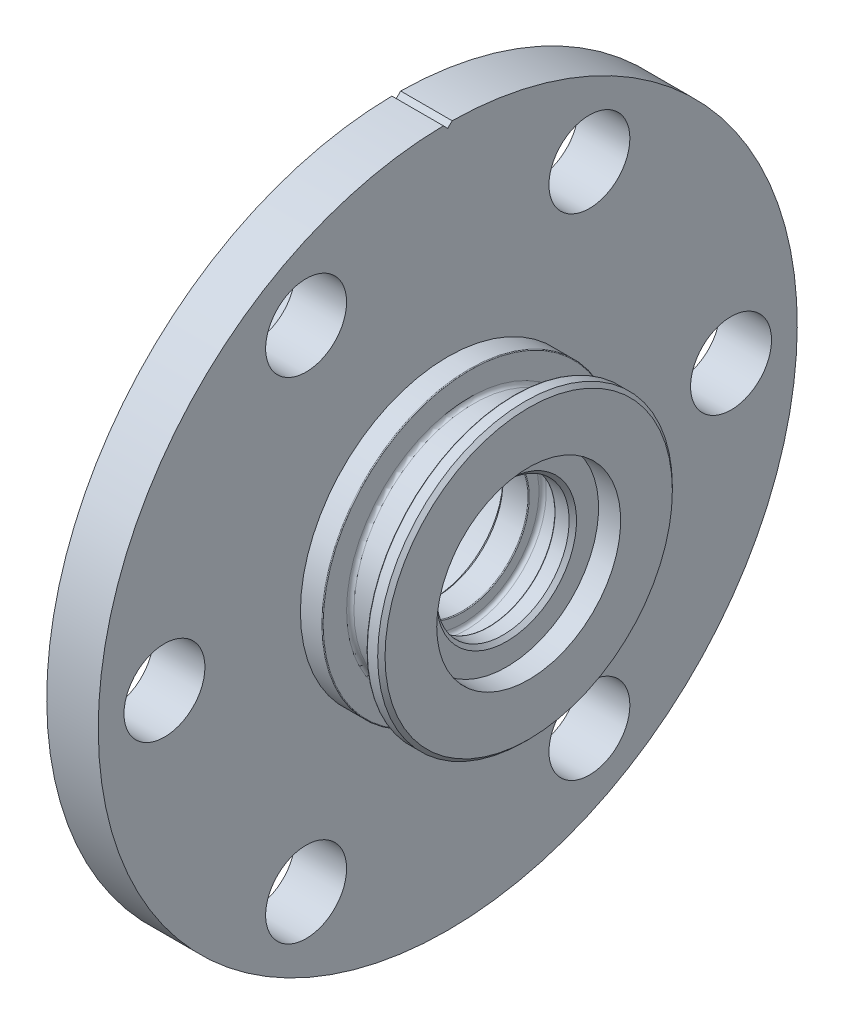
from build123d import *

# Parameters (mm, degrees)
SKETCH_2_R               = 5.5
CUT_EXTRUDE_1_DEPTH      = 70.810457669
PATTERN_CIRCULAR_1_COUNT = 6
CUT_EXTRUDE_2_DEPTH      = 70.810457669
CUT_EXTRUDE_3_DEPTH      = 4
CUT_EXTRUDE_4_DEPTH      = 3
CUT_EXTRUDE_5_DEPTH      = 0.5
CUT_EXTRUDE_6_DEPTH      = 0.5


with BuildPart() as part:
    # Эскиз1 → Повернуть1 (revolve)
    with BuildSketch(Plane.XY, mode=Mode.PRIVATE) as revolve_1_sk:
        with BuildLine():
            Line((0, 15), (17, 15))
            Line((17, 15), (17, 9.5))
            Line((17, 9.5), (17.5, 9))
            Line((17.5, 9), (20.9, 9))
            ThreePointArc((20.9, 9), (20.970710678, 9.029289322), (21, 9.1))
            Line((21, 9.1), (21, 10.4))
            ThreePointArc((21, 10.4), (21.146446609, 10.753553391), (21.5, 10.9))
            Line((21.5, 10.9), (24, 10.9))
            ThreePointArc((24, 10.9), (24.353553391, 10.753553391), (24.5, 10.4))
            Line((24.5, 10.4), (24.5, 9.1))
            ThreePointArc((24.5, 9.1), (24.529289322, 9.029289322), (24.6, 9))
            Line((24.6, 9), (26.5, 9))
            Line((26.5, 9), (27, 9.5))
            Line((27, 9.5), (27, 12.5))
            Line((27, 12.5), (30, 12.5))
            Line((30, 12.5), (30, 19.525))
            Line((30, 19.525), (29.5, 20.025))
            Line((29.5, 20.025), (28.1, 20.025))
            ThreePointArc((28.1, 20.025), (28.029289322, 19.995710678), (28, 19.925))
            Line((28, 19.925), (28, 16.75))
            ThreePointArc((28, 16.75), (27.853553391, 16.396446609), (27.5, 16.25))
            Line((27.5, 16.25), (22.5, 16.25))
            ThreePointArc((22.5, 16.25), (22.146446609, 16.396446609), (22, 16.75))
            Line((22, 16.75), (22, 19.925))
            ThreePointArc((22, 19.925), (21.970710678, 19.995710678), (21.9, 20.025))
            Line((21.9, 20.025), (19, 20.025))
            Line((19, 20.025), (19, 47.5))
            Line((19, 47.5), (12, 47.5))
            Line((12, 47.5), (12, 25))
            Line((12, 25), (0, 25))
            Line((0, 25), (0, 15))
        make_face()
    revolve(revolve_1_sk.sketch.rotate(Axis((0, 0, 0), (1, 0, 0)), 90), axis=Axis((0, 0, 0), (1, 0, 0)))

    # Эскиз2 → Вырез-Вытянуть1 (cut, through all)
    with BuildSketch(Plane(origin=(19, 0, 0), x_dir=(0, 0, -1), z_dir=(1, 0, 0))):
        with Locations((38.5, 0)):
            Circle(SKETCH_2_R)
    cut_extrude_1 = extrude(amount=-CUT_EXTRUDE_1_DEPTH, mode=Mode.SUBTRACT)

    # Круговой массив1: Вырез-Вытянуть1 ×6 about axis
    pattern_circular_1_axis = Axis((0, 0, 0), (1, 0, 0))
    for i in range(1, PATTERN_CIRCULAR_1_COUNT):
        add(cut_extrude_1.rotate(pattern_circular_1_axis, i * 360 / PATTERN_CIRCULAR_1_COUNT), mode=Mode.SUBTRACT)

    # Эскиз3 → Вырез-Вытянуть2 (cut, through all)
    with BuildSketch(Plane(origin=(19, 0, 0), x_dir=(0, 0, -1), z_dir=(1, 0, 0))):
        with BuildLine():
            Line((-0.596257505, 47.496257505), (0, 46.9))
            Line((0, 46.9), (0.596257505, 47.496257505))
            ThreePointArc((0.596257505, 47.496257505), (0, 47.5), (-0.596257505, 47.496257505))
        make_face()
    extrude(amount=-CUT_EXTRUDE_2_DEPTH, mode=Mode.SUBTRACT)

    # Эскиз4 → Вырез-Вытянуть3 (cut)
    with BuildSketch(Plane.ZY):
        with BuildLine():
            Line((-22.449944321, -11), (-10.198039027, -11))
            ThreePointArc((-10.198039027, -11), (-12.990381057, 7.5), (4.427259928, 14.331760866))
            Line((4.427259928, 14.331760866), (-1.698692719, 24.942222095))
            ThreePointArc((-1.698692719, 24.942222095), (-21.650635095, 12.5), (-22.449944321, -11))
        make_face()
    extrude(amount=-CUT_EXTRUDE_3_DEPTH, mode=Mode.SUBTRACT)

    # Эскиз5 → Вырез-Вытянуть4 (cut)
    with BuildSketch(Plane.ZY.offset(-4)):
        with BuildLine():
            Line((-24.787849846, -3.25), (-14.643684646, -3.25))
            ThreePointArc((-14.643684646, -3.25), (-15, 0), (-14.643684646, 3.25))
            Line((-14.643684646, 3.25), (-24.787849846, 3.25))
            ThreePointArc((-24.787849846, 3.25), (-25, 0), (-24.787849846, -3.25))
        make_face()
        with BuildLine():
            Line((-15.208507485, 19.841907672), (-10.136424885, 11.056802908))
            ThreePointArc((-10.136424885, 11.056802908), (-7.5, 12.990381057), (-4.507259761, 14.306802908))
            Line((-4.507259761, 14.306802908), (-9.579342361, 23.091907672))
            ThreePointArc((-9.579342361, 23.091907672), (-12.5, 21.650635095), (-15.208507485, 19.841907672))
        make_face()
    extrude(amount=-CUT_EXTRUDE_4_DEPTH, mode=Mode.SUBTRACT)

    # Эскиз6 → Вырез-Вытянуть5 (cut)
    # profile 1 of 4: a face of its own
    with BuildSketch(Plane.ZY.offset(-12)):
        with BuildLine():
            Line((-0.180554406, 39.477018573), (0.357907132, 42.078180432))
            add(Edge.make_bspline(
                [(0.357907132, 42.078180432), (0.327144435, 42.055049142), (0.264132599, 42.007668867), (0.161224433, 41.943863239), (0.05006028, 41.882293935), (-0.070751591, 41.825598544), (-0.199878164, 41.770132642), (-0.338940831, 41.720698495), (-0.486111877, 41.672171644), (-0.588223671, 41.644849669), (-0.640490304, 41.630864726)],
                knots=[0, 0, 0, 0, 0.838359274, 1.717227777, 2.63582179, 3.606248445, 4.624055798, 5.697042507, 6.821215173, 8, 8, 8, 8], degree=3))
            Line((-0.640490304, 41.630864726), (-0.560562419, 41.989839085))
            add(Edge.make_bspline(
                [(-0.560562419, 41.989839085), (-0.507209173, 42.013756687), (-0.399270795, 42.06214413), (-0.241266586, 42.147063614), (-0.08349029, 42.240751127), (0.044089891, 42.327913735), (0.143742968, 42.399707853), (0.214231776, 42.451889885), (0.279749679, 42.502534023), (0.340126411, 42.551556729), (0.395379775, 42.599197515), (0.445871232, 42.644779087), (0.491867065, 42.68810806), (0.519756203, 42.717480305), (0.533187581, 42.731625944)],
                knots=[0, 0, 0, 0, 1.583313545, 3.203184633, 4.855583746, 6.551690609, 7.386215473, 8.182603945, 8.927160296, 9.629134756, 10.288998473, 10.903058912, 11.471714409, 12, 12, 12, 12], degree=3))
            add(Edge.make_bspline(
                [(0.533187581, 42.731625944), (0.54862987, 42.749182437), (0.580285751, 42.785172326), (0.623996935, 42.844365542), (0.667114487, 42.908431815), (0.69396942, 42.953740133), (0.707766908, 42.977018573)],
                knots=[0, 0, 0, 0, 0.929584414, 1.905599249, 2.923941894, 4, 4, 4, 4], degree=3))
            Line((0.707766908, 42.977018573), (0.949653927, 42.977018573))
            Line((0.949653927, 42.977018573), (0.230302966, 39.477018573))
            Line((0.230302966, 39.477018573), (-0.180554406, 39.477018573))
        make_face()
    # profile 2 of 4: a face of its own
    with BuildSketch(Plane.ZY.offset(-12)):
        with BuildLine():
            add(Edge.make_bspline(
                [(33.658708126, 20.6558349), (33.70781934, 20.671067075), (33.80244326, 20.700415322), (33.942982258, 20.731002115), (34.07527117, 20.751407215), (34.201975519, 20.759193075), (34.325829957, 20.756482967), (34.450405191, 20.742465624), (34.577434975, 20.720198397), (34.686367299, 20.69285953), (34.780722389, 20.663773108), (34.864852683, 20.636380514), (34.961567209, 20.603287896), (35.071075572, 20.564842528), (35.192886696, 20.51968141), (35.327331683, 20.469365122), (35.474353949, 20.413081675), (35.576304887, 20.373122717), (35.629561491, 20.352249163)],
                knots=[0, 0, 0, 0, 1.204779305, 2.321281203, 3.367971213, 4.339492292, 5.292959753, 6.268180703, 7.275121332, 8.31414202, 8.898160544, 9.589397699, 10.388039475, 11.294205731, 12.309856272, 13.43320494, 14.659170863, 16, 16, 16, 16], degree=3))
            add(Edge.make_bspline(
                [(35.629561491, 20.352249163), (35.661761364, 20.339493414), (35.723665541, 20.314970518), (35.813761481, 20.281774786), (35.896133543, 20.250400904), (35.971850624, 20.224145809), (36.040182159, 20.20055545), (36.101514827, 20.18121014), (36.155643291, 20.164714375), (36.189497352, 20.15583998), (36.205182485, 20.151728329)],
                knots=[0, 0, 0, 0, 1.362870858, 2.620115953, 3.77833347, 4.831281057, 5.773586764, 6.622888737, 7.361962113, 8, 8, 8, 8], degree=3))
            add(Edge.make_bspline(
                [(36.205182485, 20.151728329), (36.245486949, 20.142398003), (36.323263041, 20.124393142), (36.438228858, 20.10933454), (36.546162786, 20.10259052), (36.615578372, 20.106890191), (36.648992581, 20.1089599)],
                knots=[0, 0, 0, 0, 1.107911723, 2.137952887, 3.103676364, 4, 4, 4, 4], degree=3))
            add(Edge.make_bspline(
                [(36.648992581, 20.1089599), (36.671079966, 20.111890814), (36.715350813, 20.117765392), (36.779870162, 20.137045291), (36.843957367, 20.161117958), (36.884339566, 20.183234895), (36.904902036, 20.194496759)],
                knots=[0, 0, 0, 0, 0.982488777, 1.969251264, 2.965950105, 4, 4, 4, 4], degree=3))
            add(Edge.make_bspline(
                [(36.904902036, 20.194496759), (36.921735941, 20.204661743), (36.954834259, 20.224647828), (36.99979837, 20.260353596), (37.041103649, 20.298705349), (37.07621987, 20.341877457), (37.108733234, 20.386920884), (37.1352222, 20.436298417), (37.15683223, 20.489285068), (37.174483505, 20.544773791), (37.185886039, 20.601957436), (37.193484681, 20.659098713), (37.194207645, 20.71606109), (37.188108549, 20.77231293), (37.178045578, 20.828168698), (37.160737988, 20.882971738), (37.138286262, 20.937461246), (37.119307678, 20.972435148), (37.1096296, 20.990269996)],
                knots=[0, 0, 0, 0, 1.029422278, 2.024019106, 3.002884985, 3.976604764, 4.934720418, 5.910132956, 6.903975558, 7.930406914, 8.955961227, 9.955446647, 10.947476769, 11.932071302, 12.916818143, 13.916228535, 14.937386339, 16, 16, 16, 16], degree=3))
            add(Edge.make_bspline(
                [(37.1096296, 20.990269996), (37.099258991, 21.007585275), (37.078789479, 21.041762181), (37.041774911, 21.088124327), (37.001426387, 21.130020511), (36.959096922, 21.169706288), (36.910604159, 21.201808729), (36.860157682, 21.231772525), (36.805809736, 21.257263669), (36.747471835, 21.277315328), (36.685664583, 21.293159702), (36.619805051, 21.301878929), (36.55015746, 21.30548299), (36.476499016, 21.302493311), (36.399036321, 21.292936928), (36.317504887, 21.278253712), (36.232125034, 21.257098872), (36.174481313, 21.239228575), (36.14488601, 21.23005365)],
                knots=[0, 0, 0, 0, 0.890791895, 1.7582455, 2.61263812, 3.46058193, 4.313975991, 5.174521437, 6.052053172, 6.959735025, 7.89619894, 8.865656837, 9.889025904, 10.973821993, 12.117354432, 13.334393261, 14.63143049, 16, 16, 16, 16], degree=3))
            Line((36.14488601, 21.23005365), (35.987834728, 21.625486342))
            add(Edge.make_bspline(
                [(35.987834728, 21.625486342), (36.023377912, 21.63942523), (36.09309944, 21.66676776), (36.199330193, 21.696511893), (36.303792639, 21.717931387), (36.406527864, 21.730339642), (36.507985583, 21.731403691), (36.60748786, 21.723810365), (36.705718407, 21.707042489), (36.801368025, 21.680222967), (36.894132268, 21.645205344), (36.982655084, 21.601921046), (37.065716279, 21.549507597), (37.143823416, 21.489633923), (37.217501383, 21.421976991), (37.285105325, 21.345109974), (37.348750098, 21.260905178), (37.385911661, 21.200010463), (37.404801876, 21.169056054)],
                knots=[0, 0, 0, 0, 1.115855542, 2.188862788, 3.220910342, 4.232248558, 5.209649385, 6.183027772, 7.147052098, 8.118701484, 9.083379673, 10.04310653, 10.995014708, 11.950498094, 12.917787316, 13.91498675, 14.940132114, 16, 16, 16, 16], degree=3))
            add(Edge.make_bspline(
                [(37.404801876, 21.169056054), (37.427786379, 21.12630376), (37.472887094, 21.042414237), (37.522171415, 20.91024722), (37.553883536, 20.776429714), (37.569586568, 20.642495513), (37.567887374, 20.510617787), (37.54787882, 20.383741948), (37.507941205, 20.263618397), (37.450101935, 20.152206611), (37.379608582, 20.050322016), (37.298935448, 19.959891575), (37.209853823, 19.880579501), (37.142998173, 19.838831404), (37.1096296, 19.817994355)],
                knots=[0, 0, 0, 0, 1.127989899, 2.21336743, 3.269451819, 4.31995369, 5.342013454, 6.327707805, 7.295477983, 8.272773045, 9.237791438, 10.169519232, 11.086381901, 12, 12, 12, 12], degree=3))
            add(Edge.make_bspline(
                [(37.1096296, 19.817994355), (37.084399482, 19.804171889), (37.033876791, 19.776492739), (36.953372801, 19.743888494), (36.869977682, 19.717588936), (36.783206349, 19.699917522), (36.693769166, 19.687330493), (36.60088303, 19.683991325), (36.504760752, 19.68528067), (36.440018138, 19.692851549), (36.407105562, 19.696700284)],
                knots=[0, 0, 0, 0, 0.950163752, 1.902679592, 2.865321406, 3.836448888, 4.826229905, 5.846936954, 6.90546815, 8, 8, 8, 8], degree=3))
            add(Edge.make_bspline(
                [(36.407105562, 19.696700284), (36.395873699, 19.698492607), (36.371695697, 19.702350808), (36.333157753, 19.710277491), (36.289590333, 19.719967898), (36.241214034, 19.732702955), (36.188053967, 19.748352986), (36.129525039, 19.765796681), (36.066272916, 19.786174649), (35.997916154, 19.808517471), (35.925176328, 19.834049445), (35.847168322, 19.861115332), (35.764449991, 19.891721128), (35.676300273, 19.923459173), (35.583595885, 19.958742559), (35.486106708, 19.996886688), (35.383367174, 20.03648651), (35.313338862, 20.064045298), (35.27759835, 20.078110541)],
                knots=[0, 0, 0, 0, 0.457246047, 0.984279848, 1.581521093, 2.251567047, 2.995007651, 3.809514434, 4.706951792, 5.666714152, 6.700824875, 7.806324329, 8.986417404, 10.246789651, 11.573106774, 12.974297352, 14.455765103, 16, 16, 16, 16], degree=3))
            add(Edge.make_bspline(
                [(35.27759835, 20.078110541), (35.247004644, 20.090086269), (35.187551502, 20.113358855), (35.100608509, 20.146315664), (35.018568104, 20.176450836), (34.941581192, 20.203976877), (34.86957926, 20.227831399), (34.802319425, 20.248050978), (34.740580941, 20.26653598), (34.665876399, 20.285748047), (34.579258602, 20.304721248), (34.48090738, 20.322206939), (34.389008558, 20.33176024), (34.329934178, 20.332340027), (34.301636812, 20.332617752)],
                knots=[0, 0, 0, 0, 1.165771828, 2.265459344, 3.299162083, 4.266999938, 5.166485247, 5.990184484, 6.759087513, 7.453007125, 8.726665259, 9.904584845, 10.996269963, 12, 12, 12, 12], degree=3))
            Line((34.301636812, 20.332617752), (35.081985369, 18.981556054))
            Line((35.081985369, 18.981556054), (34.697770626, 18.856055252))
            Line((34.697770626, 18.856055252), (33.658708126, 20.6558349))
        make_face()
    # profile 3 of 4: a face of its own
    with BuildSketch(Plane.ZY.offset(-12)):
        with BuildLine():
            Line((-36.969019669, -20.099422896), (-36.713811335, -20.435260235))
            add(Edge.make_bspline(
                [(-36.713811335, -20.435260235), (-36.737143841, -20.453717847), (-36.782413341, -20.489529127), (-36.844958157, -20.54546256), (-36.899578254, -20.601810945), (-36.948054085, -20.657059859), (-36.98794823, -20.713129227), (-37.020354994, -20.768836515), (-37.046529998, -20.823899548), (-37.063597763, -20.87953353), (-37.075347174, -20.934914308), (-37.079922645, -20.990681664), (-37.079574753, -21.046629907), (-37.072114752, -21.102729203), (-37.059439698, -21.159048394), (-37.041058785, -21.215782548), (-37.017394953, -21.273051449), (-36.99697643, -21.309747152), (-36.986547713, -21.328489402)],
                knots=[0, 0, 0, 0, 1.369991066, 2.658043362, 3.860650297, 4.982569779, 6.039844813, 7.023792536, 7.948437492, 8.840301675, 9.697322654, 10.550957523, 11.412091524, 12.269180089, 13.15177349, 14.067416344, 15.012937116, 16, 16, 16, 16], degree=3))
            add(Edge.make_bspline(
                [(-36.986547713, -21.328489402), (-36.973008483, -21.350792493), (-36.946158399, -21.395022468), (-36.897781903, -21.454888498), (-36.846367679, -21.510304627), (-36.788466143, -21.55802604), (-36.727085393, -21.601010978), (-36.660292634, -21.637763538), (-36.588921211, -21.668527595), (-36.513454694, -21.69269042), (-36.436840704, -21.710848274), (-36.360777544, -21.721699502), (-36.286582555, -21.724112409), (-36.214213479, -21.72117743), (-36.143412888, -21.709777646), (-36.07468452, -21.690613603), (-36.007536573, -21.664879048), (-35.965258583, -21.642125172), (-35.943979604, -21.630672896)],
                knots=[0, 0, 0, 0, 1.041625132, 2.065680238, 3.06994913, 4.05779477, 5.057928611, 6.061328383, 7.098925301, 8.159352125, 9.224212466, 10.24267195, 11.224138038, 12.187344575, 13.133276971, 14.082753663, 15.035028809, 16, 16, 16, 16], degree=3))
            add(Edge.make_bspline(
                [(-35.943979604, -21.630672896), (-35.925956669, -21.619838539), (-35.890647438, -21.598612651), (-35.843032099, -21.560813255), (-35.799490773, -21.520810773), (-35.761811798, -21.476654884), (-35.72940445, -21.429278247), (-35.701578583, -21.378942196), (-35.67928544, -21.32508443), (-35.662548126, -21.268185278), (-35.651247093, -21.209499617), (-35.646349981, -21.149794192), (-35.647815346, -21.08940314), (-35.655607419, -21.028581453), (-35.669593863, -20.966926242), (-35.691325859, -20.905370112), (-35.71754521, -20.8423224), (-35.740231038, -20.801738726), (-35.751872233, -20.78091328)],
                knots=[0, 0, 0, 0, 1.029331314, 2.016591381, 2.972608994, 3.92277935, 4.853428351, 5.781043041, 6.735894067, 7.703296896, 8.682488308, 9.659132008, 10.632750058, 11.636932618, 12.659169198, 13.72381926, 14.831981622, 16, 16, 16, 16], degree=3))
            add(Edge.make_bspline(
                [(-35.751872233, -20.78091328), (-35.755591517, -20.774824341), (-35.764515348, -20.760214901), (-35.780910378, -20.734759243), (-35.802300771, -20.702034845), (-35.819093325, -20.678256893), (-35.828294508, -20.665228184)],
                knots=[0, 0, 0, 0, 0.617384292, 1.481315283, 2.619931199, 4, 4, 4, 4], degree=3))
            Line((-35.828294508, -20.665228184), (-35.48123922, -20.549543088))
            add(Edge.make_bspline(
                [(-35.48123922, -20.549543088), (-35.473352026, -20.56837862), (-35.457951102, -20.605157811), (-35.439203716, -20.64034761), (-35.430057329, -20.657515844)],
                knots=[0, 0, 0, 0, 1.024249383, 2, 2, 2, 2], degree=3))
            add(Edge.make_bspline(
                [(-35.430057329, -20.657515844), (-35.414801662, -20.683021081), (-35.385019885, -20.732811841), (-35.334787655, -20.801124244), (-35.283982823, -20.863593267), (-35.229820116, -20.917700431), (-35.173373871, -20.964262254), (-35.115173994, -21.003986563), (-35.054330966, -21.035605986), (-34.992134721, -21.060387055), (-34.928897413, -21.076835761), (-34.866262569, -21.087561168), (-34.804236352, -21.091998561), (-34.743046674, -21.089251093), (-34.682907328, -21.079163264), (-34.623785684, -21.062815083), (-34.565143894, -21.040763475), (-34.528193851, -21.020460434), (-34.509484412, -21.010180107)],
                knots=[0, 0, 0, 0, 1.287028092, 2.512507782, 3.670349145, 4.773073973, 5.823309793, 6.837229631, 7.820130982, 8.788580591, 9.731818402, 10.645791963, 11.538997133, 12.420937503, 13.29329128, 14.17523165, 15.07603919, 16, 16, 16, 16], degree=3))
            add(Edge.make_bspline(
                [(-34.509484412, -21.010180107), (-34.492644717, -21.00002244), (-34.459535014, -20.98005074), (-34.414778977, -20.944340429), (-34.373538509, -20.906736652), (-34.337931698, -20.864883764), (-34.305897341, -20.820672341), (-34.279137708, -20.772644407), (-34.257644133, -20.721216948), (-34.240110536, -20.667548192), (-34.227616901, -20.612650529), (-34.220140925, -20.557482836), (-34.219908034, -20.502950479), (-34.223878254, -20.448923744), (-34.233778207, -20.395569247), (-34.249369495, -20.342761664), (-34.270339374, -20.290520451), (-34.288518711, -20.257239909), (-34.29774563, -20.240348376)],
                knots=[0, 0, 0, 0, 1.059362376, 2.082886426, 3.081592175, 4.064427905, 5.040127438, 6.021831334, 7.021331915, 8.041592118, 9.062708146, 10.053751079, 11.036829174, 11.997601602, 12.971508916, 13.956523795, 14.962834013, 16, 16, 16, 16], degree=3))
            add(Edge.make_bspline(
                [(-34.29774563, -20.240348376), (-34.307749273, -20.224267097), (-34.327610626, -20.192339133), (-34.362292136, -20.147890148), (-34.400791458, -20.107269999), (-34.443041469, -20.070595773), (-34.489173178, -20.038144892), (-34.538994853, -20.009163511), (-34.593275136, -19.98501265), (-34.650484699, -19.963756281), (-34.710561838, -19.947721744), (-34.772748168, -19.937179819), (-34.836589665, -19.932101799), (-34.902287976, -19.933864005), (-34.969576592, -19.940855331), (-35.038433797, -19.95371177), (-35.109108201, -19.971792591), (-35.155806643, -19.98849365), (-35.179756848, -19.997059113)],
                knots=[0, 0, 0, 0, 0.909723662, 1.806176172, 2.703964625, 3.59576094, 4.490170531, 5.411058555, 6.361077004, 7.341805999, 8.341707468, 9.344380847, 10.369513512, 11.414332179, 12.498439584, 13.617589987, 14.778134637, 16, 16, 16, 16], degree=3))
            Line((-35.179756848, -19.997059113), (-35.31717672, -19.587603985))
            add(Edge.make_bspline(
                [(-35.31717672, -19.587603985), (-35.282264815, -19.577871218), (-35.213726206, -19.558763974), (-35.110344214, -19.541152751), (-35.009653532, -19.530361906), (-34.911148836, -19.527069389), (-34.814685912, -19.533545212), (-34.720467098, -19.548492488), (-34.628321153, -19.570609643), (-34.539395332, -19.601819146), (-34.453697639, -19.639568193), (-34.37212056, -19.684391152), (-34.295531065, -19.736766425), (-34.223130978, -19.79493122), (-34.155363827, -19.859739056), (-34.093102276, -19.931579263), (-34.034999157, -20.009776166), (-34.000959071, -20.065943187), (-33.983643066, -20.094515043)],
                knots=[0, 0, 0, 0, 1.122356113, 2.203395343, 3.244627065, 4.258866193, 5.253105233, 6.23532493, 7.211868866, 8.185185438, 9.151336723, 10.110733909, 11.064786832, 12.022707053, 12.985596141, 13.965891906, 14.96526033, 16, 16, 16, 16], degree=3))
            add(Edge.make_bspline(
                [(-33.983643066, -20.094515043), (-33.966742296, -20.125090592), (-33.9337263, -20.184820546), (-33.894266662, -20.277314554), (-33.864695189, -20.369613736), (-33.844056502, -20.461560727), (-33.833342999, -20.55321988), (-33.832876429, -20.644382299), (-33.841038664, -20.735134018), (-33.859494935, -20.824545752), (-33.886114964, -20.911038689), (-33.919524435, -20.993500213), (-33.961087052, -21.07043064), (-34.010668847, -21.141542525), (-34.067035742, -21.207749437), (-34.130400001, -21.269098362), (-34.20149694, -21.325011912), (-34.253685113, -21.356600456), (-34.280217585, -21.372660075)],
                knots=[0, 0, 0, 0, 1.140503879, 2.227997419, 3.278092693, 4.302260543, 5.301169828, 6.285891551, 7.274834943, 8.271846685, 9.26182061, 10.227150444, 11.173245211, 12.111268484, 13.0534753, 14.008976859, 14.98776361, 16, 16, 16, 16], degree=3))
            add(Edge.make_bspline(
                [(-34.280217585, -21.372660075), (-34.319628347, -21.393529527), (-34.396851199, -21.434421875), (-34.520097004, -21.473686783), (-34.644751697, -21.493071447), (-34.770718632, -21.49241527), (-34.898170476, -21.470659969), (-35.026046842, -21.428194018), (-35.15612017, -21.367510276), (-35.238576855, -21.31368657), (-35.281419508, -21.285720972)],
                knots=[0, 0, 0, 0, 1.0013532, 1.9620872, 2.892762958, 3.828338328, 4.782276689, 5.787869431, 6.850626311, 8, 8, 8, 8], degree=3))
            add(Edge.make_bspline(
                [(-35.281419508, -21.285720972), (-35.28273403, -21.32415222), (-35.285285093, -21.398734829), (-35.305923227, -21.506159105), (-35.335970683, -21.606107975), (-35.380299846, -21.697340582), (-35.435413283, -21.780838857), (-35.501894798, -21.856895186), (-35.581404234, -21.923857453), (-35.640849296, -21.961358562), (-35.671243226, -21.980532671)],
                knots=[0, 0, 0, 0, 1.100790148, 2.136277312, 3.125860573, 4.084759447, 5.032428424, 5.986634836, 6.970577585, 8, 8, 8, 8], degree=3))
            add(Edge.make_bspline(
                [(-35.671243226, -21.980532671), (-35.70502103, -21.998780767), (-35.771777946, -22.034845475), (-35.877026954, -22.075925901), (-35.983978872, -22.10676398), (-36.093414874, -22.124416497), (-36.204946807, -22.133005863), (-36.318596849, -22.127055405), (-36.434420678, -22.112043934), (-36.550131239, -22.084335899), (-36.664000942, -22.047950111), (-36.771764289, -22.000721434), (-36.87311537, -21.945568994), (-36.965836842, -21.879368478), (-37.052672524, -21.805725822), (-37.132355857, -21.722556641), (-37.204092517, -21.629662973), (-37.245395408, -21.562363624), (-37.26629531, -21.528309113)],
                knots=[0, 0, 0, 0, 1.000834344, 1.978003533, 2.941204094, 3.89952864, 4.86527348, 5.85399825, 6.862953875, 7.908643638, 8.953764356, 9.977807834, 10.973969053, 11.958548683, 12.944656505, 13.940873708, 14.958050262, 16, 16, 16, 16], degree=3))
            add(Edge.make_bspline(
                [(-37.26629531, -21.528309113), (-37.28487243, -21.494712294), (-37.321338494, -21.428763228), (-37.365031479, -21.326943484), (-37.40018171, -21.226389782), (-37.423991118, -21.126274078), (-37.438270136, -21.026992458), (-37.442461835, -20.928355858), (-37.437108058, -20.830324373), (-37.420633826, -20.733884945), (-37.39567211, -20.639834799), (-37.360940224, -20.549449571), (-37.317538877, -20.463209289), (-37.265145798, -20.381418291), (-37.204554535, -20.303755039), (-37.134633257, -20.230717103), (-37.056007852, -20.161732728), (-36.998369291, -20.120446097), (-36.969019669, -20.099422896)],
                knots=[0, 0, 0, 0, 1.132885491, 2.223803937, 3.266883664, 4.274436901, 5.257132668, 6.224075758, 7.184818927, 8.150209605, 9.107651284, 10.053409237, 11.003887975, 11.953339181, 12.916829068, 13.907631669, 14.934563605, 16, 16, 16, 16], degree=3))
        make_face()
    # profile 4 of 4: a face of its own
    with BuildSketch(Plane.ZY.offset(-12)):
        Polygon((37.274952168, -21.395575719), (36.598369636, -20.787703122), (35.887432136, -22.019574116), (35.564214989, -21.728608571), (34.660468995, -18.951465142), (34.836450566, -18.647178283), (36.523349604, -20.157394629), (36.768742232, -19.732514821), (37.059006655, -19.990527642), (36.814315149, -20.414706328), (37.490196559, -21.023280045), align=None)
        Polygon((36.308105213, -20.529690302), (35.201033899, -19.538304084), (35.811009861, -21.390667866), align=None, mode=Mode.SUBTRACT)
    extrude(amount=-CUT_EXTRUDE_5_DEPTH, mode=Mode.SUBTRACT)

    # Эскиз7 → Вырез-Вытянуть6 (cut)
    # profile 1 of 18: a face of its own
    with BuildSketch(Plane.ZY):
        Polygon((-11.11942423, -18.963913362), (-8.941038814, -16.167839644), (-6.494824871, -17.366056791), (-8.671106923, -20.163532753), (-9.087573269, -19.95950631), (-7.146868141, -17.48664974), (-8.761551634, -16.695784355), (-10.702957884, -19.167939804), align=None)
    # profile 2 of 18: a face of its own
    with BuildSketch(Plane.ZY):
        Polygon((-7.050291927, -20.825799013), (-5.418080389, -17.680566641), (-3.007623658, -18.353643564), (-3.192719812, -18.711916801), (-5.157263081, -18.163639557), (-5.666277504, -19.141704461), (-3.752215004, -19.675959269), (-3.938713401, -20.034232506), (-5.852775901, -19.499977698), (-6.417880068, -20.59442882), (-4.314514683, -21.181968884), (-4.500311959, -21.538138756), align=None)
    # profile 3 of 18: a face of its own
    with BuildSketch(Plane.ZY):
        with BuildLine():
            Line((-2.971815883, -21.783675944), (-1.996555466, -18.367109438))
            Line((-1.996555466, -18.367109438), (-0.548037838, -18.470875463))
            add(Edge.make_bspline(
                [(-0.548037838, -18.470875463), (-0.51762703, -18.47316031), (-0.458795672, -18.47758047), (-0.374028016, -18.488635801), (-0.295080818, -18.500075111), (-0.222219028, -18.514563586), (-0.155730674, -18.532405639), (-0.094802888, -18.550920154), (-0.040236515, -18.572629567), (0.024676569, -18.604292439), (0.09789746, -18.653724885), (0.176646029, -18.72626299), (0.244101731, -18.815250113), (0.302360421, -18.915885225), (0.348792094, -19.026694882), (0.378554047, -19.144817949), (0.39431161, -19.268124657), (0.391032517, -19.351684029), (0.389362002, -19.394252867)],
                knots=[0, 0, 0, 0, 0.972471492, 1.881298882, 2.725699301, 3.516552136, 4.248782947, 4.920669622, 5.546310103, 6.119680317, 7.221574463, 8.350294852, 9.519205374, 10.768286447, 12.051507461, 13.336913162, 14.643305852, 16, 16, 16, 16], degree=3))
            add(Edge.make_bspline(
                [(0.389362002, -19.394252867), (0.385635178, -19.430350022), (0.378143952, -19.502908311), (0.353558315, -19.611465064), (0.317609058, -19.719704047), (0.271768944, -19.82662182), (0.217837296, -19.927883277), (0.158939886, -20.021427329), (0.094566729, -20.104563561), (0.0246656, -20.176489378), (-0.046680616, -20.239698224), (-0.118819864, -20.293671372), (-0.190763094, -20.339007126), (-0.262742231, -20.376068102), (-0.336284879, -20.404453684), (-0.410235818, -20.429425961), (-0.486767887, -20.448352871), (-0.538630805, -20.457456466), (-0.564864761, -20.462061361)],
                knots=[0, 0, 0, 0, 1.125787643, 2.262926958, 3.446808514, 4.662412089, 5.869781847, 7.004952089, 8.090534854, 9.127052723, 10.1139867, 11.047019228, 11.92067287, 12.751333271, 13.55565765, 14.365558284, 15.17324607, 16, 16, 16, 16], degree=3))
            add(Edge.make_bspline(
                [(-0.564864761, -20.462061361), (-0.621343626, -20.470214153), (-0.733968638, -20.486471708), (-0.904221058, -20.498788326), (-1.074673957, -20.501080542), (-1.18817869, -20.495167338), (-1.244952902, -20.492209598)],
                knots=[0, 0, 0, 0, 1.003522009, 2.001132252, 3.000181426, 4, 4, 4, 4], degree=3))
            Line((-1.244952902, -20.492209598), (-2.113642806, -20.43051088))
            Line((-2.113642806, -20.43051088), (-2.507673255, -21.81732979))
            Line((-2.507673255, -21.81732979), (-2.971815883, -21.783675944))
        make_face()
        with BuildLine():
            Line((-2.002865562, -20.043491649), (-1.238642806, -20.098179149))
            add(Edge.make_bspline(
                [(-1.238642806, -20.098179149), (-1.202663216, -20.10052023), (-1.133317871, -20.105032318), (-1.032768561, -20.107728677), (-0.939423039, -20.107548669), (-0.853138738, -20.102286075), (-0.774006368, -20.094987863), (-0.701970043, -20.084142555), (-0.637421428, -20.068530484), (-0.561035012, -20.044674716), (-0.47423668, -20.004913612), (-0.380270375, -19.943049456), (-0.295091686, -19.868907755), (-0.221635548, -19.782218449), (-0.15995697, -19.687289427), (-0.112591401, -19.586725475), (-0.080541504, -19.481534469), (-0.072504227, -19.409414375), (-0.06847053, -19.373219213)],
                knots=[0, 0, 0, 0, 1.109878218, 2.139126373, 3.096051899, 3.98243506, 4.79928199, 5.542117789, 6.222694699, 6.84160838, 8.003907305, 9.147348152, 10.294562853, 11.468251706, 12.633708394, 13.769882881, 14.880763394, 16, 16, 16, 16], degree=3))
            add(Edge.make_bspline(
                [(-0.06847053, -19.373219213), (-0.067080684, -19.346105005), (-0.064415593, -19.294112327), (-0.071535937, -19.219119326), (-0.087126058, -19.151071953), (-0.113044652, -19.090544913), (-0.146080457, -19.036854235), (-0.186512394, -18.989608728), (-0.235244567, -18.950166858), (-0.281633758, -18.922020945), (-0.325470351, -18.903631083), (-0.365610983, -18.890539531), (-0.412390394, -18.878009553), (-0.466445613, -18.866734329), (-0.527552348, -18.857248195), (-0.59587022, -18.849023955), (-0.67090057, -18.841276708), (-0.723309091, -18.836993275), (-0.750662037, -18.834757675)],
                knots=[0, 0, 0, 0, 1.289180448, 2.472059797, 3.568794165, 4.594341745, 5.587110251, 6.555968276, 7.534649805, 8.555915834, 9.123391928, 9.790911697, 10.561670445, 11.424532156, 12.414499303, 13.500375768, 14.695401373, 16, 16, 16, 16], degree=3))
            Line((-0.750662037, -18.834757675), (-1.640385594, -18.770955592))
            Line((-1.640385594, -18.770955592), (-2.002865562, -20.043491649))
        make_face(mode=Mode.SUBTRACT)
    # profile 4 of 18: a face of its own
    with BuildSketch(Plane.ZY):
        Polygon((1.232262221, -21.947766477), (1.493079529, -18.414813752), (3.973648439, -18.083884265), (3.943500202, -18.486328175), (1.922867189, -18.755558944), (1.840835939, -19.854917919), (3.809585939, -19.591997246), (3.779437702, -19.995142278), (1.80998658, -20.258062951), (1.721645234, -21.486428335), (3.885307093, -21.197566156), (3.855158856, -21.597906701), align=None)
    # profile 5 of 18: a face of its own
    with BuildSketch(Plane.ZY):
        Polygon((5.371948313, -21.31803197), (4.977216742, -17.781573637), (7.574872992, -16.927607291), (7.971707928, -20.463364502), (7.529300076, -20.608496714), (7.190658249, -17.471677803), (5.475714338, -18.035379727), (5.814356165, -21.172198637), align=None)
    # profile 6 of 18: a face of its own
    with BuildSketch(Plane.ZY):
        with BuildLine():
            Line((8.186249666, -16.61133384), (8.591498063, -16.386273744))
            Line((8.591498063, -16.386273744), (10.354819377, -17.902099065))
            Line((10.354819377, -17.902099065), (10.44947082, -15.352119097))
            Line((10.44947082, -15.352119097), (10.877856236, -15.113737687))
            Line((10.877856236, -15.113737687), (10.706782518, -18.563958039))
            add(Edge.make_bspline(
                [(10.706782518, -18.563958039), (10.703460838, -18.6161356), (10.697127026, -18.715628282), (10.677903955, -18.856997897), (10.653426162, -18.983804282), (10.621072246, -19.09665897), (10.577896918, -19.196897239), (10.518324503, -19.283547385), (10.443417222, -19.358033834), (10.383237413, -19.394979776), (10.352716012, -19.413717654)],
                knots=[0, 0, 0, 0, 1.300208268, 2.479249837, 3.546432931, 4.510344366, 5.395186744, 6.248231421, 7.111555302, 8, 8, 8, 8], degree=3))
            add(Edge.make_bspline(
                [(10.352716012, -19.413717654), (10.344113067, -19.418477728), (10.325264614, -19.428906719), (10.293578977, -19.443853415), (10.257336937, -19.461597447), (10.215430427, -19.480627581), (10.168073653, -19.501326156), (10.115649617, -19.524597682), (10.057957332, -19.549231675), (10.017604564, -19.565687131), (9.99654614, -19.574274545)],
                knots=[0, 0, 0, 0, 0.603587471, 1.322418193, 2.150423646, 3.081568715, 4.148172534, 5.324063268, 6.603540458, 8, 8, 8, 8], degree=3))
            Line((9.99654614, -19.574274545), (9.878056557, -19.624054193))
            Line((9.878056557, -19.624054193), (9.756762486, -19.235632719))
            add(Edge.make_bspline(
                [(9.756762486, -19.235632719), (9.782937941, -19.226051385), (9.832026362, -19.208082928), (9.900761749, -19.182911725), (9.959791688, -19.160909903), (10.00957457, -19.143087926), (10.049613063, -19.127449832), (10.080182536, -19.115463346), (10.101604855, -19.107655907), (10.112023997, -19.102244545), (10.115736845, -19.100316212)],
                knots=[0, 0, 0, 0, 1.743412875, 3.269528225, 4.578348618, 5.683592724, 6.576698929, 7.266206627, 7.738513603, 8, 8, 8, 8], degree=3))
            add(Edge.make_bspline(
                [(10.115736845, -19.100316212), (10.129522712, -19.091296568), (10.157902661, -19.072728491), (10.193363339, -19.032149123), (10.223899276, -18.982004633), (10.249683951, -18.921709895), (10.270331469, -18.851508742), (10.28706033, -18.771344369), (10.298632624, -18.680603375), (10.30283111, -18.616572092), (10.30503973, -18.582888328)],
                knots=[0, 0, 0, 0, 0.689000354, 1.418394253, 2.238047845, 3.147738346, 4.162836802, 5.30602547, 6.582830145, 8, 8, 8, 8], degree=3))
            Line((10.30503973, -18.582888328), (10.311349826, -18.444066212))
            Line((10.311349826, -18.444066212), (8.186249666, -16.61133384))
        make_face()
    # profile 7 of 18: a face of its own
    with BuildSketch(Plane.ZY):
        with BuildLine():
            Line((14.363155874, -15.038648308), (14.756485201, -14.797462411))
            add(Edge.make_bspline(
                [(14.756485201, -14.797462411), (14.772930151, -14.846601487), (14.80524447, -14.943159743), (14.843438792, -15.088453307), (14.869734622, -15.231012251), (14.887365712, -15.37027933), (14.892784274, -15.5065217), (14.888059087, -15.639689883), (14.872576725, -15.769833415), (14.846884815, -15.896523363), (14.810488179, -16.018497547), (14.767631893, -16.136160026), (14.714382923, -16.247920989), (14.653646823, -16.355028921), (14.583026649, -16.455837858), (14.505037173, -16.551925824), (14.417761622, -16.642008216), (14.354005822, -16.697038924), (14.321789688, -16.724846225)],
                knots=[0, 0, 0, 0, 1.175495571, 2.309848146, 3.404954046, 4.462535234, 5.492096044, 6.494957171, 7.482833043, 8.462434611, 9.423886193, 10.368462165, 11.30064849, 12.229314296, 13.158933317, 14.089776466, 15.034754198, 16, 16, 16, 16], degree=3))
            add(Edge.make_bspline(
                [(14.321789688, -16.724846225), (14.28166925, -16.756673803), (14.203332578, -16.818818352), (14.079232757, -16.897519317), (13.953878084, -16.961776999), (13.8272467, -17.012231035), (13.698803583, -17.047349535), (13.569109172, -17.068813306), (13.437841979, -17.075051476), (13.30593416, -17.066542048), (13.174361181, -17.043503366), (13.044736802, -17.004633726), (12.917646312, -16.95002358), (12.793303871, -16.879867469), (12.670483143, -16.795304454), (12.551021152, -16.694388275), (12.433103848, -16.579037937), (12.359866162, -16.493373774), (12.322190329, -16.44930536)],
                knots=[0, 0, 0, 0, 1.072378221, 2.093859012, 3.072730479, 4.020187417, 4.944368558, 5.857221154, 6.769035708, 7.691451061, 8.621244716, 9.561589467, 10.520216132, 11.513252412, 12.548210832, 13.639702084, 14.785786464, 16, 16, 16, 16], degree=3))
            add(Edge.make_bspline(
                [(12.322190329, -16.44930536), (12.275096114, -16.389540189), (12.182636804, -16.272204195), (12.064202815, -16.08603578), (11.96438496, -15.897115274), (11.885509818, -15.704321129), (11.826697005, -15.507994004), (11.788445343, -15.30836051), (11.768121749, -15.105183169), (11.771974382, -14.969037736), (11.773913085, -14.900527315)],
                knots=[0, 0, 0, 0, 1.08457405, 2.129326709, 3.141596067, 4.128178458, 5.095159897, 6.059311141, 7.023416296, 8, 8, 8, 8], degree=3))
            add(Edge.make_bspline(
                [(11.773913085, -14.900527315), (11.778692758, -14.840293183), (11.788099232, -14.721751445), (11.824373171, -14.549002348), (11.87492596, -14.384175774), (11.943807094, -14.227973349), (12.028930046, -14.079959887), (12.131485219, -13.9405976), (12.25020399, -13.809216685), (12.340270629, -13.730866311), (12.385992412, -13.691092219)],
                knots=[0, 0, 0, 0, 1.036855333, 2.040547938, 3.024461411, 3.993233993, 4.96608099, 5.951172782, 6.959925274, 8, 8, 8, 8], degree=3))
            add(Edge.make_bspline(
                [(12.385992412, -13.691092219), (12.421175411, -13.663528909), (12.489938702, -13.609657892), (12.59671378, -13.538131841), (12.705404597, -13.479168143), (12.814433375, -13.430406468), (12.924603876, -13.393623497), (13.03546518, -13.368387072), (13.147167796, -13.353087273), (13.259236899, -13.350865041), (13.370373891, -13.358078887), (13.478957714, -13.377488156), (13.585152578, -13.405905524), (13.687626502, -13.446620749), (13.788000176, -13.49634088), (13.884714488, -13.557794211), (13.97869141, -13.629742727), (14.037336196, -13.684278045), (14.067282476, -13.712125872)],
                knots=[0, 0, 0, 0, 1.150981455, 2.249531767, 3.305481135, 4.332289363, 5.322137514, 6.291736316, 7.257159224, 8.220590831, 9.173984548, 10.121067297, 11.057124439, 12.000584711, 12.956256098, 13.938257595, 14.947195161, 16, 16, 16, 16], degree=3))
            Line((14.067282476, -13.712125872), (13.760892252, -14.017814975))
            add(Edge.make_bspline(
                [(13.760892252, -14.017814975), (13.736804342, -13.998368132), (13.689859568, -13.960468303), (13.617512178, -13.909708641), (13.545187642, -13.8665855), (13.472755165, -13.83164575), (13.401018184, -13.803021594), (13.329361174, -13.782610672), (13.257928575, -13.769922744), (13.18701302, -13.764250152), (13.116547637, -13.76562947), (13.046783985, -13.774092506), (12.97774557, -13.789639767), (12.909439109, -13.812232758), (12.841729307, -13.842044751), (12.774776533, -13.878535784), (12.708008741, -13.921364058), (12.666144713, -13.955011415), (12.644706355, -13.972242058)],
                knots=[0, 0, 0, 0, 1.205504255, 2.349399543, 3.439024516, 4.481194918, 5.478474544, 6.443710926, 7.37753487, 8.299752521, 9.210170435, 10.11789972, 11.032131871, 11.961865536, 12.915660716, 13.9094449, 14.929437217, 16, 16, 16, 16], degree=3))
            add(Edge.make_bspline(
                [(12.644706355, -13.972242058), (12.605941145, -14.006381866), (12.529810235, -14.07342896), (12.432516949, -14.188480915), (12.35153162, -14.311815907), (12.288970215, -14.444878576), (12.243136048, -14.586233503), (12.214414163, -14.736184026), (12.203043755, -14.894848134), (12.209040751, -15.002902134), (12.212114207, -15.058279719)],
                knots=[0, 0, 0, 0, 1.015445556, 1.994231293, 2.95483414, 3.911509117, 4.878739615, 5.871868202, 6.909334219, 8, 8, 8, 8], degree=3))
            add(Edge.make_bspline(
                [(12.212114207, -15.058279719), (12.217095715, -15.107250779), (12.227052769, -15.205134285), (12.257461184, -15.349643611), (12.297778604, -15.492227251), (12.351643939, -15.631661391), (12.416308875, -15.769119691), (12.493273598, -15.903890822), (12.581309978, -16.036920515), (12.648490352, -16.121199241), (12.682566931, -16.163948789)],
                knots=[0, 0, 0, 0, 0.967058991, 1.932960469, 2.898512235, 3.877189694, 4.867786214, 5.882133643, 6.925733285, 8, 8, 8, 8], degree=3))
            add(Edge.make_bspline(
                [(12.682566931, -16.163948789), (12.710701571, -16.196538446), (12.765405647, -16.259904713), (12.851512351, -16.346806875), (12.940104407, -16.421168033), (13.029619351, -16.484809739), (13.120011046, -16.538102807), (13.212373654, -16.578798609), (13.305829085, -16.608969441), (13.40029801, -16.626777667), (13.494566585, -16.634876858), (13.587598627, -16.631560696), (13.679182059, -16.620197138), (13.768689009, -16.597299522), (13.856275274, -16.56472039), (13.941982471, -16.522414463), (14.026073488, -16.470274092), (14.078868969, -16.429018311), (14.105844175, -16.407939174)],
                knots=[0, 0, 0, 0, 1.264712401, 2.459065543, 3.589625047, 4.658385541, 5.682936938, 6.666617818, 7.61772071, 8.561683854, 9.484841405, 10.391587904, 11.291785716, 12.191040364, 13.099137658, 14.032629715, 14.994796183, 16, 16, 16, 16], degree=3))
            add(Edge.make_bspline(
                [(14.105844175, -16.407939174), (14.128162079, -16.388684117), (14.172396137, -16.350520619), (14.232297193, -16.286912473), (14.285345889, -16.218804279), (14.333066628, -16.14688815), (14.373169213, -16.070170808), (14.409039896, -15.989999302), (14.436703469, -15.904792228), (14.458169214, -15.815925115), (14.474161084, -15.724415351), (14.480605229, -15.630509299), (14.480832937, -15.535368513), (14.473144611, -15.43847392), (14.456494091, -15.340435471), (14.433422322, -15.24059812), (14.402620239, -15.139335343), (14.376465464, -15.072605604), (14.363155874, -15.038648308)],
                knots=[0, 0, 0, 0, 0.944674143, 1.872343031, 2.795764885, 3.710265169, 4.635509567, 5.568339673, 6.523330353, 7.502964199, 8.498377825, 9.497844959, 10.516979822, 11.546912242, 12.610085025, 13.7025383, 14.830872279, 16, 16, 16, 16], degree=3))
        make_face()
    # profile 8 of 18: a face of its own
    with BuildSketch(Plane.ZY):
        with BuildLine():
            Line((14.116748501, -11.96057793), (14.407012924, -11.598097962))
            Line((14.407012924, -11.598097962), (15.39349129, -12.801924084))
            add(Edge.make_bspline(
                [(15.39349129, -12.801924084), (15.414003808, -12.775112459), (15.453157545, -12.723935159), (15.502792521, -12.645912375), (15.5406023, -12.570629436), (15.567183039, -12.495849154), (15.582431839, -12.416986277), (15.585680813, -12.330235933), (15.579639561, -12.233564128), (15.563734712, -12.126969826), (15.538233091, -12.010626574), (15.502720335, -11.885374936), (15.458454186, -11.750796618), (15.423124933, -11.659176893), (15.404709238, -11.611419276)],
                knots=[0, 0, 0, 0, 0.960573054, 1.833515729, 2.627818077, 3.353625226, 4.08550364, 4.904680638, 5.817566108, 6.839216018, 7.969127711, 9.205428069, 10.543303888, 12, 12, 12, 12], degree=3))
            add(Edge.make_bspline(
                [(15.404709238, -11.611419276), (15.389672488, -11.573355613), (15.36093713, -11.500615631), (15.321085488, -11.396103627), (15.285506452, -11.301476854), (15.256529535, -11.216149077), (15.231308865, -11.140624019), (15.212095137, -11.074574469), (15.196565038, -11.018215528), (15.184545659, -10.955852529), (15.17716894, -10.884319899), (15.179375482, -10.800471817), (15.191854995, -10.717476152), (15.215761421, -10.636330635), (15.246036067, -10.557951201), (15.283180961, -10.484041844), (15.323746727, -10.414054277), (15.356327394, -10.371747696), (15.372457636, -10.350802289)],
                knots=[0, 0, 0, 0, 1.462710487, 2.795252111, 3.997749551, 5.075499284, 6.015858407, 6.843132183, 7.534002742, 8.104083828, 9.111430193, 10.097389995, 11.094432892, 12.101813887, 13.114720497, 14.093435719, 15.056086192, 16, 16, 16, 16], degree=3))
            add(Edge.make_bspline(
                [(15.372457636, -10.350802289), (15.374291029, -10.348433639), (15.379466619, -10.341747042), (15.390951082, -10.330473387), (15.406329997, -10.312948175), (15.427551428, -10.291111922), (15.452202688, -10.262780448), (15.482948033, -10.230391338), (15.518610861, -10.192881098), (15.543583178, -10.165520907), (15.556852668, -10.150982577)],
                knots=[0, 0, 0, 0, 0.264147286, 0.745676323, 1.417224481, 2.321970672, 3.431972026, 4.730782629, 6.262842445, 8, 8, 8, 8], degree=3))
            Line((15.556852668, -10.150982577), (15.807153149, -10.453867193))
            add(Edge.make_bspline(
                [(15.807153149, -10.453867193), (15.79972902, -10.462098588), (15.780238413, -10.483708519), (15.759620845, -10.504250672), (15.746856674, -10.516968154)],
                knots=[0, 0, 0, 0, 0.761816054, 2, 2, 2, 2], degree=3))
            add(Edge.make_bspline(
                [(15.746856674, -10.516968154), (15.736307572, -10.527453441), (15.716966769, -10.546677243), (15.691263559, -10.573092168), (15.671429204, -10.593960217), (15.66081365, -10.606443475), (15.656411963, -10.611619596)],
                knots=[0, 0, 0, 0, 1.362858149, 2.49867422, 3.377482596, 4, 4, 4, 4], degree=3))
            add(Edge.make_bspline(
                [(15.656411963, -10.611619596), (15.644608405, -10.627753409), (15.621349125, -10.659545592), (15.600659085, -10.715579227), (15.589384776, -10.775239972), (15.591515897, -10.81630211), (15.592609879, -10.837380814)],
                knots=[0, 0, 0, 0, 0.992622678, 1.955994071, 2.950736644, 4, 4, 4, 4], degree=3))
            add(Edge.make_bspline(
                [(15.592609879, -10.837380814), (15.59385414, -10.849322606), (15.596476754, -10.874493143), (15.604024187, -10.914188262), (15.613406011, -10.958093471), (15.627522827, -11.005931108), (15.642594339, -11.05845204), (15.660644277, -11.11518505), (15.683023179, -11.175568406), (15.698265934, -11.21738204), (15.70619161, -11.239123603)],
                knots=[0, 0, 0, 0, 0.688076881, 1.450307092, 2.315054769, 3.261105624, 4.308395642, 5.448281032, 6.673199275, 8, 8, 8, 8], degree=3))
            add(Edge.make_bspline(
                [(15.70619161, -11.239123603), (15.722228315, -11.281604916), (15.753067446, -11.363297935), (15.795169008, -11.481798854), (15.831761252, -11.591465245), (15.863286576, -11.692450071), (15.890416975, -11.784546445), (15.910664368, -11.868422659), (15.926216124, -11.943234864), (15.940724928, -12.030587259), (15.946655917, -12.133398132), (15.93705924, -12.253134809), (15.909625427, -12.369700222), (15.878794948, -12.443089075), (15.863242892, -12.48010918)],
                knots=[0, 0, 0, 0, 1.269007391, 2.44034463, 3.514384794, 4.499785451, 5.396966543, 6.196969808, 6.910466557, 7.532201453, 8.670568906, 9.77818426, 10.87923236, 12, 12, 12, 12], degree=3))
            add(Edge.make_bspline(
                [(15.863242892, -12.48010918), (15.891805739, -12.465309905), (15.950711774, -12.434788907), (16.050730966, -12.407338208), (16.16104684, -12.390688421), (16.282631385, -12.385990767), (16.415356244, -12.3954775), (16.559328264, -12.416322307), (16.714960257, -12.448325721), (16.821155331, -12.478463584), (16.876363886, -12.494131616)],
                knots=[0, 0, 0, 0, 0.741369664, 1.528949388, 2.381073409, 3.315832803, 4.332875705, 5.450652245, 6.674648447, 8, 8, 8, 8], degree=3))
            Line((16.876363886, -12.494131616), (17.877565809, -12.794211744))
            Line((17.877565809, -12.794211744), (17.560658758, -13.190345558))
            Line((17.560658758, -13.190345558), (16.724220456, -12.940746199))
            add(Edge.make_bspline(
                [(16.724220456, -12.940746199), (16.684305444, -12.929124436), (16.607271617, -12.906695059), (16.495594555, -12.8771442), (16.392389603, -12.853561244), (16.298170905, -12.833592751), (16.212093426, -12.821717529), (16.134784672, -12.812465329), (16.06587443, -12.809431358), (16.004101469, -12.811919047), (15.947277315, -12.820637427), (15.89264321, -12.834633477), (15.83948459, -12.855288067), (15.786895941, -12.881077313), (15.736629644, -12.914810513), (15.686513623, -12.953196807), (15.638169484, -12.998480093), (15.607588854, -13.031690468), (15.591908758, -13.048718955)],
                knots=[0, 0, 0, 0, 1.633354422, 3.152286172, 4.537708864, 5.792857102, 6.934301791, 7.95034021, 8.850948635, 9.641474665, 10.375192237, 11.105685168, 11.852613678, 12.612301554, 13.401813713, 14.226478742, 15.09063403, 16, 16, 16, 16], degree=3))
            Line((15.591908758, -13.048718955), (16.64359145, -14.334576327))
            Line((16.64359145, -14.334576327), (16.353327027, -14.697757417))
            Line((16.353327027, -14.697757417), (14.116748501, -11.96057793))
        make_face()
    # profile 9 of 18: a face of its own
    with BuildSketch(Plane.ZY):
        Polygon((17.071183174, -7.155674675), (17.892897917, -5.081055284), (18.228735257, -5.302609771), (17.574588622, -6.955153842), (20.180658334, -8.686223553), (20.014492469, -9.10689663), align=None)
    # profile 10 of 18: a face of its own
    with BuildSketch(Plane.ZY):
        Polygon((17.918883105, -4.485365115), (18.008626695, -4.051370724), (20.509528137, -5.14371848), (18.373210028, -2.27262473), (18.461551375, -1.844940436), (21.716158746, -3.273125532), (21.6278174, -3.705016557), (19.145846246, -2.614772166), (21.263935189, -5.474647968), (21.173490477, -5.916354698), align=None)
    # profile 11 of 18: a face of its own
    with BuildSketch(Plane.ZY):
        with BuildLine():
            Line((18.465148472, -0.655647766), (18.508618023, 1.630009285))
            Line((18.508618023, 1.630009285), (21.572520267, 0.911359446))
            Line((21.572520267, 0.911359446), (21.578129241, 1.228266497))
            Line((21.578129241, 1.228266497), (22.657155683, 0.968150311))
            Line((22.657155683, 0.968150311), (22.649443343, 0.56149967))
            Line((22.649443343, 0.56149967), (21.961642863, 0.730470023))
            Line((21.961642863, 0.730470023), (21.914667702, -1.737478695))
            Line((21.914667702, -1.737478695), (22.602468183, -1.90715017))
            Line((22.602468183, -1.90715017), (22.594755843, -2.308892958))
            Line((22.594755843, -2.308892958), (21.515729401, -2.048776772))
            Line((21.515729401, -2.048776772), (21.521338376, -1.764822445))
            add(Edge.make_bspline(
                [(21.521338376, -1.764822445), (21.492265892, -1.738667403), (21.431663197, -1.684146224), (21.329240173, -1.607991808), (21.213115916, -1.533370587), (21.083902312, -1.45882762), (20.940357181, -1.386312048), (20.783471522, -1.314184232), (20.612566509, -1.243572461), (20.428361013, -1.17358217), (20.230324139, -1.104860682), (20.018547599, -1.037975914), (19.793229228, -0.97130849), (19.554369082, -0.905511738), (19.301691793, -0.840981311), (19.035103021, -0.778192167), (18.754875177, -0.715735102), (18.563124519, -0.675967328), (18.465148472, -0.655647766)],
                knots=[0, 0, 0, 0, 0.571630016, 1.191584439, 1.863681138, 2.58940594, 3.371970953, 4.214568958, 5.113925928, 6.075537754, 7.095841067, 8.178850712, 9.322937977, 10.53181014, 11.801689434, 13.136307926, 14.536780866, 16, 16, 16, 16], degree=3))
        make_face()
        with BuildLine():
            add(Edge.make_bspline(
                [(18.867592382, -0.277743119), (18.903628531, -0.285014989), (18.981565605, -0.300742204), (19.105770619, -0.330673552), (19.246315447, -0.36638609), (19.40264257, -0.40933154), (19.574981125, -0.459384456), (19.763705347, -0.515323434), (19.968386859, -0.578610605), (20.18426564, -0.647050548), (20.401111096, -0.718142098), (20.607215103, -0.793283627), (20.798270129, -0.868951941), (20.97458398, -0.945133563), (21.136007393, -1.022560076), (21.281894148, -1.101836009), (21.413198226, -1.181230335), (21.492915017, -1.238264981), (21.531154081, -1.265623727)],
                knots=[0, 0, 0, 0, 0.617725101, 1.335983112, 2.146580683, 3.054545993, 4.060098925, 5.162275082, 6.362285804, 7.660231217, 8.967978927, 10.196700473, 11.346055009, 12.420747263, 13.42372, 14.35336543, 15.210131737, 16, 16, 16, 16], degree=3))
            Line((21.531154081, -1.265623727), (21.563405683, 0.45212467))
            Line((21.563405683, 0.45212467), (18.893533888, 1.07331858))
            Line((18.893533888, 1.07331858), (18.867592382, -0.277743119))
        make_face(mode=Mode.SUBTRACT)
    # profile 12 of 18: a face of its own
    with BuildSketch(Plane.ZY):
        with BuildLine():
            Line((21.853749588, 2.37175495), (18.313785645, 2.434855912))
            Line((18.313785645, 2.434855912), (18.042451511, 3.856730912))
            add(Edge.make_bspline(
                [(18.042451511, 3.856730912), (18.03711742, 3.88661477), (18.026805675, 3.944385576), (18.014962407, 4.028802691), (18.006046432, 4.107805298), (18.002407917, 4.181765363), (17.999910961, 4.250342789), (18.00420289, 4.31373447), (18.009666795, 4.371981574), (18.024022718, 4.442538774), (18.051757155, 4.525896652), (18.102684253, 4.619715483), (18.17041242, 4.70779499), (18.2528443, 4.789844033), (18.347706283, 4.863278163), (18.454247069, 4.921967802), (18.568867358, 4.969061584), (18.650208279, 4.987401839), (18.691690293, 4.99675495)],
                knots=[0, 0, 0, 0, 0.970951887, 1.877022467, 2.726553972, 3.512808411, 4.245603265, 4.919475555, 5.543615967, 6.115415566, 7.219452978, 8.339971721, 9.513718397, 10.761282641, 12.051700368, 13.336953713, 14.641907146, 16, 16, 16, 16], degree=3))
            add(Edge.make_bspline(
                [(18.691690293, 4.99675495), (18.727366063, 5.002389265), (18.799336745, 5.013755676), (18.910080728, 5.01754542), (19.023329978, 5.010002536), (19.137565817, 4.993548291), (19.248986984, 4.967596486), (19.354587379, 4.935523912), (19.451089997, 4.89369897), (19.538833953, 4.84530495), (19.617334847, 4.791942033), (19.688375693, 4.737257116), (19.750303363, 4.679699684), (19.803903937, 4.619380543), (19.851574931, 4.557072137), (19.893459568, 4.491235925), (19.932501547, 4.422716375), (19.95453168, 4.374571808), (19.965628594, 4.350320655)],
                knots=[0, 0, 0, 0, 1.123694266, 2.266889852, 3.440613796, 4.653818769, 5.855822293, 6.999573479, 8.084921405, 9.123812403, 10.114684028, 11.037470045, 11.912671887, 12.742316987, 13.547084545, 14.352378224, 15.170067788, 16, 16, 16, 16], degree=3))
            add(Edge.make_bspline(
                [(19.965628594, 4.350320655), (19.987774172, 4.297985001), (20.031988927, 4.193494247), (20.086640233, 4.032623643), (20.134092331, 3.869564275), (20.156843523, 3.758754258), (20.168252793, 3.703185239)],
                knots=[0, 0, 0, 0, 1.003260831, 2.003060505, 2.998574559, 4, 4, 4, 4], degree=3))
            Line((20.168252793, 3.703185239), (20.330211927, 2.851322258))
            Line((20.330211927, 2.851322258), (21.767511607, 2.826782995))
            Line((21.767511607, 2.826782995), (21.853749588, 2.37175495))
        make_face()
        with BuildLine():
            Line((19.929170261, 2.858333476), (19.786141415, 3.608533796))
            add(Edge.make_bspline(
                [(19.786141415, 3.608533796), (19.778999953, 3.643608279), (19.765208169, 3.711345068), (19.743538898, 3.809231584), (19.71758445, 3.898647538), (19.692613528, 3.981011236), (19.663711774, 4.054688212), (19.636118662, 4.121821895), (19.604032175, 4.179860907), (19.56157624, 4.247198647), (19.501006751, 4.320179159), (19.418032216, 4.395312973), (19.324824466, 4.458496904), (19.222074781, 4.506643995), (19.114906223, 4.541753824), (19.005999561, 4.561743075), (18.896640736, 4.566143075), (18.825052391, 4.555485718), (18.789146222, 4.550140367)],
                knots=[0, 0, 0, 0, 1.106323483, 2.136561847, 3.096957092, 3.983281108, 4.794848454, 5.54219579, 6.224134252, 6.841255217, 8.000967689, 9.141286935, 10.29117355, 11.467168735, 12.636646813, 13.767202381, 14.880108102, 16, 16, 16, 16], degree=3))
            add(Edge.make_bspline(
                [(18.789146222, 4.550140367), (18.762548531, 4.544252922), (18.711804417, 4.533020625), (18.641550793, 4.506468609), (18.579636626, 4.474913766), (18.527988892, 4.434700651), (18.484261375, 4.389773441), (18.450575393, 4.337901464), (18.42317565, 4.28167763), (18.408936558, 4.229414126), (18.400990653, 4.182753864), (18.399873812, 4.140924638), (18.399318944, 4.092719124), (18.403709168, 4.038037758), (18.408738221, 3.976451501), (18.418389375, 3.908489706), (18.430188597, 3.834138023), (18.439855959, 3.782623291), (18.444895421, 3.755769373)],
                knots=[0, 0, 0, 0, 1.298145012, 2.476651767, 3.574027374, 4.599960307, 5.585843688, 6.550757243, 7.538341782, 8.558440669, 9.123071385, 9.792954345, 10.551207808, 11.422754286, 12.408069962, 13.499366823, 14.69645449, 16, 16, 16, 16], degree=3))
            Line((18.444895421, 3.755769373), (18.611061286, 2.882171617))
            Line((18.611061286, 2.882171617), (19.929170261, 2.858333476))
        make_face(mode=Mode.SUBTRACT)
    # profile 13 of 18: a face of its own
    with BuildSketch(Plane.ZY):
        Polygon((21.178225917, 5.984674377), (17.247036013, 6.610075018), (17.055629763, 7.121893928), (20.099900597, 8.869790562), (20.256951879, 8.449818607), (19.381250757, 7.943608671), (19.872036013, 6.631108671), (21.000842103, 6.460034953), align=None)
        with BuildLine():
            Line((19.468189859, 6.692106268), (19.067148193, 7.765523736))
            Line((19.067148193, 7.765523736), (18.300120949, 7.334333832))
            add(Edge.make_bspline(
                [(18.300120949, 7.334333832), (18.262733352, 7.313758898), (18.18970674, 7.273571302), (18.082428147, 7.214731844), (17.978477761, 7.161510163), (17.87995331, 7.109680772), (17.785190624, 7.063138181), (17.695208287, 7.019179493), (17.609294327, 6.979490976), (17.553218962, 6.954500402), (17.526082488, 6.942406748)],
                knots=[0, 0, 0, 0, 1.180085224, 2.304978975, 3.383142248, 4.409245223, 5.383228128, 6.302366709, 7.178466643, 8, 8, 8, 8], degree=3))
            add(Edge.make_bspline(
                [(17.526082488, 6.942406748), (17.582428644, 6.94049716), (17.701338743, 6.936467259), (17.888415918, 6.921102257), (18.093188313, 6.897817931), (18.235201037, 6.877353942), (18.309235533, 6.866685594)],
                knots=[0, 0, 0, 0, 0.859207319, 1.813228006, 2.859985532, 4, 4, 4, 4], degree=3))
            Line((18.309235533, 6.866685594), (19.468189859, 6.692106268))
        make_face(mode=Mode.SUBTRACT)
    # profile 14 of 18: a face of its own
    with BuildSketch(Plane.ZY):
        with BuildLine():
            Line((19.594992194, 9.964062463), (16.263962547, 8.786878969))
            Line((16.263962547, 8.786878969), (15.707271842, 9.701842911))
            add(Edge.make_bspline(
                [(15.707271842, 9.701842911), (15.683949524, 9.740998609), (15.640495369, 9.813953523), (15.582819276, 9.916835331), (15.537231733, 10.005068456), (15.513288511, 10.060003824), (15.502544278, 10.084655411)],
                knots=[0, 0, 0, 0, 1.258702917, 2.34521587, 3.257435484, 4, 4, 4, 4], degree=3))
            add(Edge.make_bspline(
                [(15.502544278, 10.084655411), (15.489170728, 10.120172338), (15.463222739, 10.189083951), (15.437822427, 10.293402982), (15.421595655, 10.393518847), (15.417180982, 10.490214186), (15.424279478, 10.584039636), (15.446346797, 10.674240482), (15.478056839, 10.762333388), (15.524734483, 10.845370338), (15.579997643, 10.924704881), (15.647157793, 10.996520413), (15.722607416, 11.062434086), (15.779452216, 11.098929683), (15.80823338, 11.117407815)],
                knots=[0, 0, 0, 0, 1.149851231, 2.230995497, 3.249344073, 4.221182648, 5.159898498, 6.091606002, 7.028902942, 7.989853608, 8.971052826, 9.954067495, 10.964121276, 12, 12, 12, 12], degree=3))
            add(Edge.make_bspline(
                [(15.80823338, 11.117407815), (15.828662313, 11.129111366), (15.868868419, 11.152145081), (15.930957751, 11.182010133), (15.993896952, 11.205702545), (16.057692515, 11.224076397), (16.121881483, 11.237532783), (16.1871121, 11.24509749), (16.252738531, 11.248096333), (16.319125935, 11.245207543), (16.385688388, 11.236666121), (16.45277441, 11.22298839), (16.519317921, 11.201313064), (16.586285647, 11.174812811), (16.652680385, 11.141642451), (16.719310367, 11.102705656), (16.785524548, 11.057353555), (16.828336878, 11.023260519), (16.850100367, 11.00592945)],
                knots=[0, 0, 0, 0, 1.003029579, 1.974058805, 2.93213354, 3.865035535, 4.800538292, 5.723232649, 6.660165394, 7.597098138, 8.550659623, 9.517441263, 10.509535604, 11.528456138, 12.583948086, 13.668495062, 14.814788098, 16, 16, 16, 16], degree=3))
            add(Edge.make_bspline(
                [(16.850100367, 11.00592945), (16.84479016, 11.029462367), (16.834391171, 11.075546921), (16.825928989, 11.144340866), (16.820422354, 11.210559189), (16.820796878, 11.27451727), (16.824339597, 11.336514753), (16.834717937, 11.396177177), (16.848295188, 11.453810055), (16.873777195, 11.526768819), (16.916701135, 11.612354656), (16.984090607, 11.705189825), (17.067067676, 11.787696517), (17.132743124, 11.830837535), (17.166306297, 11.852884578)],
                knots=[0, 0, 0, 0, 0.891136127, 1.745113517, 2.559369839, 3.345462634, 4.107405175, 4.851560577, 5.580672799, 6.293692645, 7.703761387, 9.101632097, 10.518800782, 12, 12, 12, 12], degree=3))
            add(Edge.make_bspline(
                [(17.166306297, 11.852884578), (17.186649487, 11.86499609), (17.227319974, 11.88920965), (17.292227077, 11.917816667), (17.358212103, 11.943593804), (17.426464902, 11.963924147), (17.496837159, 11.979070318), (17.568869374, 11.990763168), (17.643216401, 11.995824996), (17.743956897, 11.998061234), (17.869664521, 11.987757378), (18.016967122, 11.958009688), (18.158154428, 11.907566759), (18.292316105, 11.838479856), (18.41816762, 11.752272529), (18.532717382, 11.648556695), (18.638367402, 11.530602895), (18.696162708, 11.440795896), (18.725601169, 11.395052046)],
                knots=[0, 0, 0, 0, 0.629259873, 1.258028137, 1.883838636, 2.513282763, 3.149871221, 3.797923614, 4.452622264, 5.13041178, 6.477481039, 7.798004459, 9.117473685, 10.452147222, 11.802440768, 13.162929658, 14.554917501, 16, 16, 16, 16], degree=3))
            Line((18.725601169, 11.395052046), (19.594992194, 9.964062463))
        make_face()
        with BuildLine():
            Line((17.446755015, 9.684314867), (17.082171681, 10.283072879))
            add(Edge.make_bspline(
                [(17.082171681, 10.283072879), (17.060716241, 10.317375197), (17.019318303, 10.383560984), (16.954962398, 10.476317394), (16.890604356, 10.558734632), (16.825898805, 10.630377434), (16.762124182, 10.692723934), (16.698442284, 10.744773023), (16.635103152, 10.7870994), (16.571097511, 10.817942636), (16.507796119, 10.841088281), (16.443758998, 10.854301999), (16.379540485, 10.859909829), (16.314657952, 10.858236062), (16.249786338, 10.846354609), (16.184639984, 10.827253397), (16.119125601, 10.799942393), (16.077213873, 10.775745138), (16.055729374, 10.763341309)],
                knots=[0, 0, 0, 0, 1.506109393, 2.906014591, 4.201002311, 5.3961245, 6.497532928, 7.518028782, 8.454344701, 9.325969749, 10.157048186, 10.957361835, 11.752170415, 12.553051395, 13.365521927, 14.199736949, 15.077161643, 16, 16, 16, 16], degree=3))
            add(Edge.make_bspline(
                [(16.055729374, 10.763341309), (16.035912392, 10.750583001), (15.997427912, 10.725806432), (15.947867434, 10.680056619), (15.906587982, 10.62990966), (15.874322271, 10.575180153), (15.85132562, 10.517662499), (15.836516561, 10.458658611), (15.8330842, 10.398308374), (15.835719712, 10.346604241), (15.845485032, 10.3028292), (15.85659041, 10.264977517), (15.873335499, 10.222907944), (15.893397411, 10.175901039), (15.919031261, 10.124607073), (15.949337963, 10.068710979), (15.983478067, 10.007806256), (16.008414582, 9.966104162), (16.021374406, 9.944431052)],
                knots=[0, 0, 0, 0, 1.197144983, 2.324849526, 3.414882072, 4.491539479, 5.542483342, 6.557573418, 7.570711931, 8.607572158, 9.178896295, 9.848529832, 10.612529285, 11.480558238, 12.448309057, 13.528178515, 14.715362927, 16, 16, 16, 16], degree=3))
            Line((16.021374406, 9.944431052), (16.403485784, 9.315524802))
            Line((16.403485784, 9.315524802), (17.446755015, 9.684314867))
        make_face(mode=Mode.SUBTRACT)
        with BuildLine():
            Line((18.978005015, 10.226282014), (18.568549887, 10.899358937))
            add(Edge.make_bspline(
                [(18.568549887, 10.899358937), (18.555594337, 10.920942348), (18.530792892, 10.962260534), (18.493201402, 11.020126788), (18.45988099, 11.072840055), (18.429006322, 11.119513944), (18.400088187, 11.159737363), (18.375071277, 11.195309237), (18.352198327, 11.224414275), (18.337464365, 11.241549269), (18.330869598, 11.249218713)],
                knots=[0, 0, 0, 0, 1.426816529, 2.731425099, 3.911061991, 4.961894486, 5.902851367, 6.719061983, 7.426665566, 8, 8, 8, 8], degree=3))
            add(Edge.make_bspline(
                [(18.330869598, 11.249218713), (18.307070828, 11.275661156), (18.261326464, 11.326487006), (18.187052198, 11.39195755), (18.112942133, 11.445943804), (18.037359802, 11.487202656), (17.960951059, 11.51799624), (17.882356269, 11.537616108), (17.801594298, 11.547506826), (17.719423477, 11.547439846), (17.637804355, 11.537582689), (17.558745931, 11.518936434), (17.483566481, 11.489741903), (17.436678134, 11.464056989), (17.413101169, 11.45114179)],
                knots=[0, 0, 0, 0, 1.242669294, 2.38857367, 3.45413814, 4.441277507, 5.390958907, 6.326193488, 7.264527299, 8.228542875, 9.19120744, 10.132417567, 11.060919632, 12, 12, 12, 12], degree=3))
            add(Edge.make_bspline(
                [(17.413101169, 11.45114179), (17.396574781, 11.440401885), (17.364558805, 11.419595853), (17.320461373, 11.385126577), (17.282555217, 11.347820911), (17.249910768, 11.308455218), (17.223240772, 11.266606439), (17.200979446, 11.223212818), (17.185695153, 11.177049379), (17.175555544, 11.128404999), (17.171784719, 11.075747394), (17.177468922, 11.01849667), (17.19046068, 10.956329295), (17.211187411, 10.888885108), (17.23953122, 10.815902896), (17.275459347, 10.737549614), (17.318908851, 10.653822224), (17.352711466, 10.597690741), (17.370332739, 10.56842945)],
                knots=[0, 0, 0, 0, 0.930759643, 1.803127206, 2.638385954, 3.438396378, 4.21310146, 4.978310309, 5.735836464, 6.502238777, 7.320994049, 8.21849314, 9.210046823, 10.317097527, 11.547151419, 12.90567733, 14.386932401, 16, 16, 16, 16], degree=3))
            Line((17.370332739, 10.56842945), (17.825360784, 9.818930251))
            Line((17.825360784, 9.818930251), (18.978005015, 10.226282014))
        make_face(mode=Mode.SUBTRACT)
    # profile 15 of 18: a face of its own
    with BuildSketch(Plane.ZY):
        with BuildLine():
            Line((14.207127417, 11.799077201), (12.702520045, 13.506308772))
            Line((12.702520045, 13.506308772), (15.796570526, 15.241585214))
            Line((15.796570526, 15.241585214), (16.105064116, 14.891725438))
            Line((16.105064116, 14.891725438), (13.359471167, 13.358372073))
            Line((13.359471167, 13.358372073), (14.256907064, 12.341044348))
            Line((14.256907064, 12.341044348), (15.955725173, 13.290363259))
            add(Edge.make_bspline(
                [(15.955725173, 13.290363259), (16.009125457, 13.319791927), (16.111593393, 13.376261567), (16.260532305, 13.453891827), (16.398740476, 13.518562011), (16.524159642, 13.574329102), (16.638676038, 13.617291176), (16.741617105, 13.649309084), (16.832975861, 13.670338601), (16.914590115, 13.680506516), (16.990304582, 13.678971981), (17.06340923, 13.667737895), (17.135527728, 13.646434837), (17.206565293, 13.614929693), (17.276581911, 13.573389467), (17.345500651, 13.521499104), (17.41385329, 13.460336157), (17.456515206, 13.413912846), (17.478561712, 13.389922554)],
                knots=[0, 0, 0, 0, 1.724061912, 3.308242045, 4.747844103, 6.038149961, 7.188254664, 8.204167291, 9.084358021, 9.836017807, 10.5234049, 11.218750613, 11.921343611, 12.643310279, 13.410581303, 14.218116155, 15.079171382, 16, 16, 16, 16], degree=3))
            add(Edge.make_bspline(
                [(17.478561712, 13.389922554), (17.490936984, 13.375372096), (17.518404695, 13.343076422), (17.558562491, 13.285189928), (17.604690688, 13.21572624), (17.635815068, 13.164291212), (17.652439917, 13.136817586)],
                knots=[0, 0, 0, 0, 0.745148351, 1.653904663, 2.746851172, 4, 4, 4, 4], degree=3))
            Line((17.652439917, 13.136817586), (17.301177898, 12.936997874))
            add(Edge.make_bspline(
                [(17.301177898, 12.936997874), (17.293027458, 12.950804152), (17.277521312, 12.977070487), (17.255167362, 13.013905653), (17.23547382, 13.046496419), (17.218072458, 13.074245125), (17.20319514, 13.097663694), (17.190913786, 13.11661341), (17.180247551, 13.13060897), (17.174048751, 13.138459865), (17.171470366, 13.141725438)],
                knots=[0, 0, 0, 0, 1.586579885, 3.018455827, 4.263930732, 5.354871045, 6.259523358, 7.010022445, 7.588219654, 8, 8, 8, 8], degree=3))
            add(Edge.make_bspline(
                [(17.171470366, 13.141725438), (17.154757353, 13.158029823), (17.121319455, 13.190650176), (17.054437201, 13.220435488), (16.977794909, 13.233064601), (16.906670139, 13.22994769), (16.842511106, 13.219227763), (16.78523944, 13.203006721), (16.720517765, 13.180498055), (16.647813577, 13.151367267), (16.567392517, 13.115539204), (16.479202264, 13.072820479), (16.383746037, 13.022513201), (16.317695796, 12.986620472), (16.283149052, 12.967847233)],
                knots=[0, 0, 0, 0, 0.861829938, 1.724272126, 2.667960076, 3.727937451, 4.353222207, 5.082081944, 5.936133434, 6.898807789, 7.991226277, 9.206847454, 10.539076858, 12, 12, 12, 12], degree=3))
            Line((16.283149052, 12.967847233), (14.207127417, 11.799077201))
        make_face()
    # profile 16 of 18: a face of its own
    with BuildSketch(Plane.ZY):
        Polygon((12.007171395, 14.014114831), (11.654507133, 14.285448966), (13.738942229, 16.06068935), (10.210897357, 15.397428132), (9.86454319, 15.663854415), (12.584194633, 17.97054512), (12.93475553, 17.700613229), (10.860136139, 15.942199767), (14.370652966, 16.594944158), (14.728225081, 16.319403293), align=None)
    # profile 17 of 18: a face of its own
    with BuildSketch(Plane.ZY):
        with BuildLine():
            Line((9.058877306, 16.127865043), (8.649422178, 16.34941953))
            Line((8.649422178, 16.34941953), (9.66184205, 17.540625459))
            add(Edge.make_bspline(
                [(9.66184205, 17.540625459), (9.631672033, 17.556013803), (9.574127781, 17.585364489), (9.488208729, 17.62074139), (9.406643617, 17.643042191), (9.328153379, 17.656294353), (9.247772256, 17.656704981), (9.161792666, 17.644430586), (9.067262881, 17.621910222), (8.965361823, 17.585798201), (8.855015236, 17.540180868), (8.737385725, 17.48308697), (8.612515137, 17.414729856), (8.527943141, 17.363792529), (8.483957435, 17.337300139)],
                knots=[0, 0, 0, 0, 0.960655065, 1.832288512, 2.630069121, 3.354901615, 4.08420768, 4.899967166, 5.813338335, 6.8364749, 7.963030605, 9.199533674, 10.543483697, 12, 12, 12, 12], degree=3))
            add(Edge.make_bspline(
                [(8.483957435, 17.337300139), (8.449160543, 17.315758569), (8.382534111, 17.274512415), (8.286742072, 17.216097092), (8.198980801, 17.165273414), (8.12046635, 17.119767461), (8.049975429, 17.082088374), (7.988104176, 17.051328352), (7.935463022, 17.025975866), (7.876381971, 17.002970397), (7.807138329, 16.982760678), (7.724157007, 16.970563662), (7.639606977, 16.967099885), (7.555097995, 16.97646828), (7.472115491, 16.992361499), (7.392399444, 17.014983782), (7.31650593, 17.043404516), (7.268720981, 17.067409009), (7.245075223, 17.079287318)],
                knots=[0, 0, 0, 0, 1.458203196, 2.79205617, 3.997452961, 5.071623463, 6.025327938, 6.844611497, 7.533806067, 8.105960888, 9.102230921, 10.096201465, 11.087692361, 12.108507623, 13.117777843, 14.095748736, 15.057706159, 16, 16, 16, 16], degree=3))
            add(Edge.make_bspline(
                [(7.245075223, 17.079287318), (7.242512459, 17.080936266), (7.235365285, 17.085534939), (7.221424082, 17.093699876), (7.20135953, 17.105772402), (7.1759657, 17.122629598), (7.144238648, 17.143051835), (7.106189379, 17.166826667), (7.062163989, 17.194735446), (7.03097659, 17.215035815), (7.014406153, 17.225821774)],
                knots=[0, 0, 0, 0, 0.267596426, 0.746287466, 1.418576008, 2.323715787, 3.422453272, 4.7321168, 6.263713625, 8, 8, 8, 8], degree=3))
            Line((7.014406153, 17.225821774), (7.268212242, 17.527304145))
            add(Edge.make_bspline(
                [(7.268212242, 17.527304145), (7.278073512, 17.521298383), (7.303327448, 17.505918099), (7.327684904, 17.489148235), (7.342531153, 17.478926742)],
                knots=[0, 0, 0, 0, 0.780968932, 2, 2, 2, 2], degree=3))
            add(Edge.make_bspline(
                [(7.342531153, 17.478926742), (7.354627935, 17.470198616), (7.376555515, 17.454377327), (7.406904285, 17.434095006), (7.430618783, 17.418456379), (7.444636416, 17.410176841), (7.450503909, 17.406711197)],
                knots=[0, 0, 0, 0, 1.377384535, 2.496755757, 3.37077284, 4, 4, 4, 4], degree=3))
            add(Edge.make_bspline(
                [(7.450503909, 17.406711197), (7.468695373, 17.398246887), (7.504888696, 17.381406489), (7.563975479, 17.369548223), (7.625298771, 17.370346923), (7.665393722, 17.379534791), (7.686080832, 17.384275299)],
                knots=[0, 0, 0, 0, 0.989906869, 1.96949627, 2.95235552, 4, 4, 4, 4], degree=3))
            add(Edge.make_bspline(
                [(7.686080832, 17.384275299), (7.710338611, 17.391971916), (7.764936134, 17.409294864), (7.851039091, 17.45031627), (7.952774307, 17.502942287), (8.024008931, 17.545126182), (8.062583236, 17.567969209)],
                knots=[0, 0, 0, 0, 0.726482354, 1.635110024, 2.71938698, 4, 4, 4, 4], degree=3))
            add(Edge.make_bspline(
                [(8.062583236, 17.567969209), (8.101497678, 17.591534646), (8.176318053, 17.636843656), (8.286080481, 17.699086755), (8.387733334, 17.755205389), (8.481267055, 17.805387988), (8.568008431, 17.847491875), (8.646708908, 17.883242024), (8.717679974, 17.912407377), (8.801410109, 17.94144466), (8.901782531, 17.966215334), (9.021965929, 17.977427627), (9.142351578, 17.971603986), (9.220550568, 17.954050374), (9.260099262, 17.945172735)],
                knots=[0, 0, 0, 0, 1.266319201, 2.434738192, 3.512095938, 4.498653008, 5.388968469, 6.195504092, 6.904643131, 7.523905494, 8.661565423, 9.772403074, 10.873405537, 12, 12, 12, 12], degree=3))
            add(Edge.make_bspline(
                [(9.260099262, 17.945172735), (9.240253924, 17.970754675), (9.199347741, 18.023485425), (9.153843524, 18.11730612), (9.118156182, 18.223619542), (9.092851481, 18.343170517), (9.077047814, 18.475954451), (9.071156772, 18.621716709), (9.075464892, 18.78099659), (9.086217251, 18.891036632), (9.091830031, 18.948478024)],
                knots=[0, 0, 0, 0, 0.743177188, 1.531873318, 2.383725738, 3.319169938, 4.337533141, 5.456941004, 6.672511883, 8, 8, 8, 8], degree=3))
            Line((9.091830031, 18.948478024), (9.208917371, 19.991046133))
            Line((9.208917371, 19.991046133), (9.656233076, 19.749159113))
            Line((9.656233076, 19.749159113), (9.559478268, 18.878365844))
            add(Edge.make_bspline(
                [(9.559478268, 18.878365844), (9.555008647, 18.83679014), (9.546405972, 18.756769441), (9.538230995, 18.641233906), (9.533092479, 18.535103435), (9.531522364, 18.438520656), (9.533520689, 18.351275523), (9.538628696, 18.273258247), (9.548342714, 18.204610631), (9.561544418, 18.143906696), (9.580139291, 18.089334918), (9.604508708, 18.038299105), (9.633753581, 17.989219976), (9.669273421, 17.942444547), (9.710944522, 17.898405682), (9.757923109, 17.856219769), (9.811182693, 17.816676913), (9.849563015, 17.792756375), (9.869374101, 17.780409113)],
                knots=[0, 0, 0, 0, 1.637547032, 3.151784464, 4.535375103, 5.798624805, 6.933931668, 7.952552417, 8.858655381, 9.646932013, 10.382142498, 11.110943804, 11.858135449, 12.616014526, 13.406042827, 14.229255279, 15.085980107, 16, 16, 16, 16], degree=3))
            Line((9.869374101, 17.780409113), (10.951205031, 19.04873844))
            Line((10.951205031, 19.04873844), (11.361361281, 18.827183953))
            Line((11.361361281, 18.827183953), (9.058877306, 16.127865043))
        make_face()
    # profile 18 of 18: a face of its own
    with BuildSketch(Plane.ZY):
        Polygon((8.40795247, 20.337116906), (5.438000547, 17.649015945), (4.917067054, 17.821491906), (5.465344297, 21.310975079), (5.893729714, 21.169348477), (5.739482919, 20.163939823), (7.077924425, 19.720830848), (7.922776188, 20.497673797), align=None)
        with BuildLine():
            Line((6.77503981, 19.443186618), (5.680588688, 19.804965464))
            Line((5.680588688, 19.804965464), (5.534755355, 18.931367707))
            add(Edge.make_bspline(
                [(5.534755355, 18.931367707), (5.527344678, 18.889054532), (5.512840718, 18.806240424), (5.490456323, 18.685165463), (5.468018347, 18.569941165), (5.445399399, 18.460368362), (5.423521237, 18.35618127), (5.399877784, 18.258242127), (5.37785037, 18.16570061), (5.361727273, 18.106343064), (5.353865932, 18.077401361)],
                knots=[0, 0, 0, 0, 1.180629343, 2.3106932, 3.383964011, 4.406847658, 5.385727697, 6.309620026, 7.175800249, 8, 8, 8, 8], degree=3))
            add(Edge.make_bspline(
                [(5.353865932, 18.077401361), (5.390926011, 18.120468231), (5.469076828, 18.211285926), (5.599296291, 18.348193361), (5.746727087, 18.493939771), (5.852113906, 18.59251925), (5.907051028, 18.643907771)],
                knots=[0, 0, 0, 0, 0.860436967, 1.814455139, 2.860696767, 4, 4, 4, 4], degree=3))
            Line((5.907051028, 18.643907771), (6.77503981, 19.443186618))
        make_face(mode=Mode.SUBTRACT)
    extrude(amount=-CUT_EXTRUDE_6_DEPTH, mode=Mode.SUBTRACT)


solid = part.part
